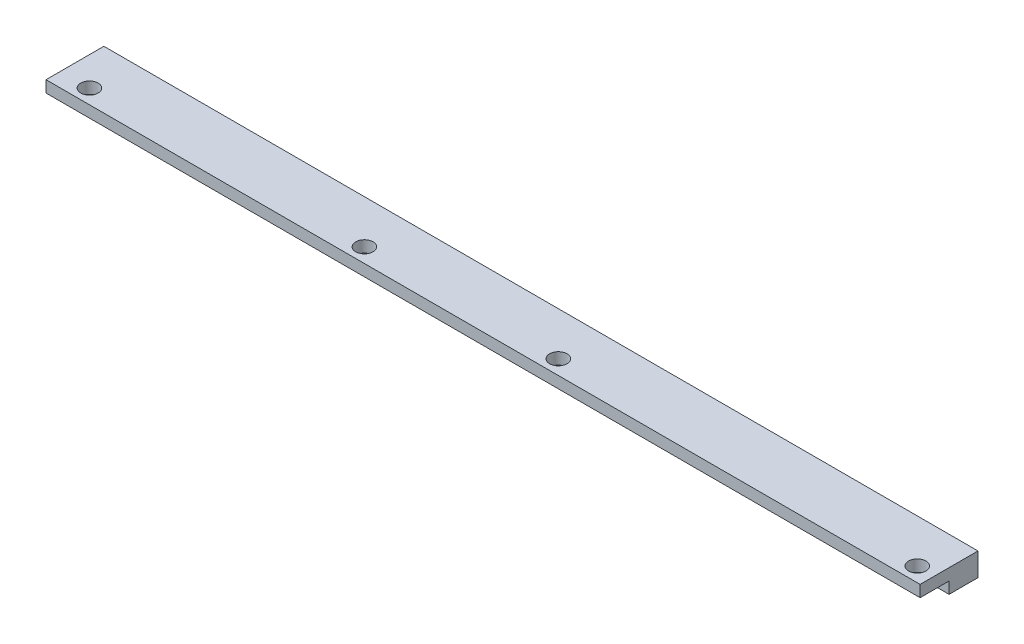
from build123d import *

# Parameters (mm, degrees)
SKETCH_1_W      = 151
SKETCH_1_H      = 5
SKETCH_1_R      = 1.5
EXTRUDE_1_DEPTH = 2
EXTRUDE_START   = 2
SKETCH_2_W      = 151
SKETCH_2_H      = 5
EXTRUDE_2_DEPTH = 4


with BuildPart() as part:
    # 草图1 → 凸台-拉伸1 (new body)
    with BuildSketch(Plane(origin=(0, 0, 0), x_dir=(1, 0, 0), z_dir=(0, 1, 0))):
        with Locations((75.5, -2.5)):
            Rectangle(SKETCH_1_W, SKETCH_1_H)
        with Locations(Location((5, -2.5, 0), (0, 0, 270))):
            Circle(SKETCH_1_R, mode=Mode.SUBTRACT)
        with Locations(Location((52.5, -2.5, 0), (0, 0, 270))):
            Circle(SKETCH_1_R, mode=Mode.SUBTRACT)
        with Locations(Location((86, -2.5, 0), (0, 0, 270))):
            Circle(SKETCH_1_R, mode=Mode.SUBTRACT)
        with Locations(Location((148, -2.5, 0), (0, 0, 270))):
            Circle(SKETCH_1_R, mode=Mode.SUBTRACT)
    extrude(amount=EXTRUDE_1_DEPTH)

    # 草图2 → 凸台-拉伸2 (add)
    with BuildSketch(Plane(origin=(0, 0, 0), x_dir=(1, 0, 0), z_dir=(0, 1, 0)).offset(EXTRUDE_START)):
        with Locations((75.5, 2.5)):
            Rectangle(SKETCH_2_W, SKETCH_2_H)
    extrude(amount=-EXTRUDE_2_DEPTH)


solid = part.part
